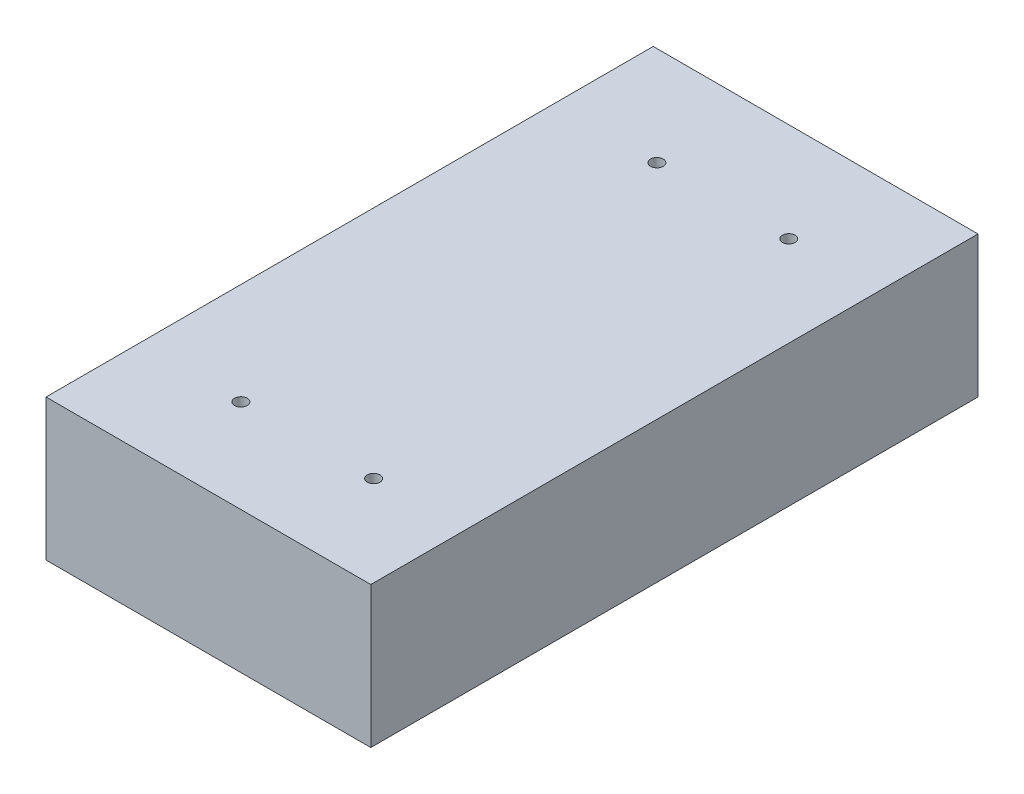
from build123d import *

# Parameters (mm, degrees)
SKETCH_1_W          = 115
SKETCH_1_H          = 215
EXTRUDE_1_DEPTH     = 50
SKETCH_2_R          = 2.25
CUT_EXTRUDE_1_DEPTH = 132.766839531


with BuildPart() as part:
    # 草图1 → 凸台-拉伸1 (new body)
    with BuildSketch(Plane(origin=(0, 0, 0), x_dir=(1, 0, 0), z_dir=(0, 1, 0))):
        Rectangle(SKETCH_1_W, SKETCH_1_H)
    extrude(amount=EXTRUDE_1_DEPTH)

    # 草图2 → 切除-拉伸1 (cut, through all)
    with BuildSketch(Plane.XZ):
        with Locations(Location((25.5, 74.5, 0), (0, 0, 270))):
            Circle(SKETCH_2_R)
        with Locations(Location((-21.5, 74.5, 0), (0, 0, 270))):
            Circle(SKETCH_2_R)
        with Locations(Location((25.5, -72.5, 0), (0, 0, 270))):
            Circle(SKETCH_2_R)
        with Locations(Location((-21.2, -72.5, 0), (0, 0, 270))):
            Circle(SKETCH_2_R)
    extrude(amount=-CUT_EXTRUDE_1_DEPTH, mode=Mode.SUBTRACT)


solid = part.part
